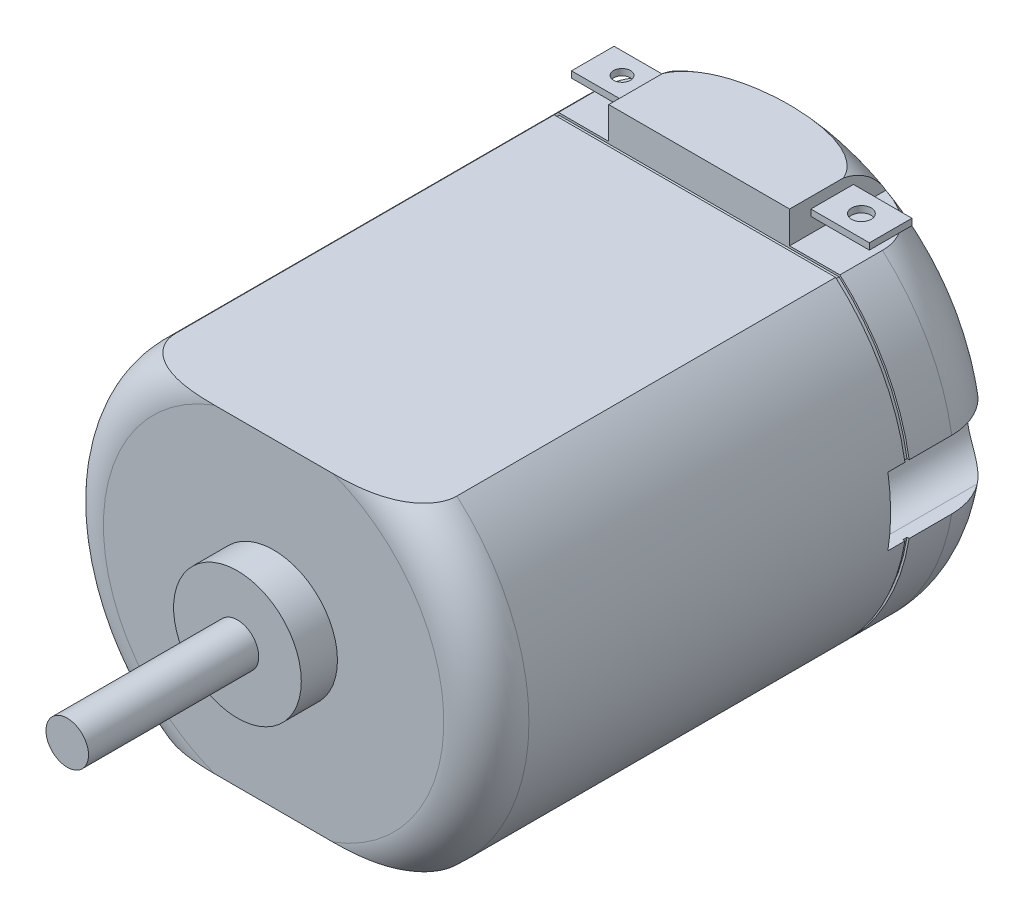
from build123d import *

# Parameters (mm, degrees)
SKETCH_1_R            = 10
EXTRUDE_1_DEPTH       = 25
CUT_EXTRUDE_START     = 5
SKETCH_2_W            = 45.854835026
SKETCH_2_H            = 35
SKETCH_2_W_2          = 25.854835026
SKETCH_2_H_2          = 15
CUT_EXTRUDE_2_DEPTH   = 25
SKETCH_3_R            = 3
EXTRUDE_2_DEPTH       = 1.7
SKETCH_4_R            = 1
EXTRUDE_3_DEPTH       = 8
FILLET_1_R            = 2
FILLET_2_R            = 3
SKETCH_5_W            = 5
SKETCH_5_H            = 0.8
EXTRUDE_4_DEPTH       = 2
EXTRUDE_START         = 1
SKETCH_6_R            = 1
EXTRUDE_5_DEPTH       = 1
CUT_EXTRUDE_1_DEPTH   = 6
CUT_EXTRUDE_3_DEPTH   = 0.2
SKETCH_9_W            = 22.189526506
SKETCH_9_H            = 4.332571278
CUT_EXTRUDE_2_2_DEPTH = 5
EXTRUDE_7_DEPTH       = 7
EXTRUDE_7_DEPTH_BACK  = 7
SKETCH_11_W           = 2
SKETCH_11_H           = 0.3
CUT_EXTRUDE_3_2_REACH = 41.498
SKETCH_12_R           = 0.462491299
SKETCH_12_R_2         = 0.396984266


with BuildPart() as part:
    # Эскиз1 → Бобышка-Вытянуть1 (new body)
    with BuildSketch(Plane.XY):
        Circle(SKETCH_1_R)
    extrude(amount=EXTRUDE_1_DEPTH)

    # Эскиз2 → Cut-Extrude 2 (cut)
    with BuildSketch(Plane.XY.offset(CUT_EXTRUDE_START)):
        Rectangle(SKETCH_2_W, SKETCH_2_H)
        Rectangle(SKETCH_2_W_2, SKETCH_2_H_2, mode=Mode.SUBTRACT)
    extrude(amount=CUT_EXTRUDE_2_DEPTH, mode=Mode.SUBTRACT)

    # Эскиз3 → Бобышка-Вытянуть2 (add)
    with BuildSketch(Plane.XY.offset(25)):
        Circle(SKETCH_3_R)
    extrude(amount=EXTRUDE_2_DEPTH)

    # Эскиз4 → Бобышка-Вытянуть3 (add)
    with BuildSketch(Plane.XY.offset(26.7)):
        Circle(SKETCH_4_R)
    extrude(amount=EXTRUDE_3_DEPTH)

    # Скругление1
    fillet_1_edges = [part.edges().sort_by_distance(p)[0] for p in [
        (-10, 0, 25),
        (9.114378278, 4.114378278, 25),
    ]]
    fillet(fillet_1_edges, radius=FILLET_1_R)

    # Скругление2
    fillet_2_edges = [part.edges().sort_by_distance(p)[0] for p in [
        (-10, 0, 0),
    ]]
    fillet(fillet_2_edges, radius=FILLET_2_R)

    # Эскиз5 → Бобышка-Вытянуть4 (add)
    with BuildSketch(Plane(origin=(0, 0, 0), x_dir=(-1, 0, 0), z_dir=(0, 0, -1))):
        with BuildLine():
            Line((-3.570714214, -3.5), (3.570714214, -3.5))
            ThreePointArc((3.570714214, -3.5), (0, 5), (-3.570714214, -3.5))
        make_face()
        with Locations((0, 2.6)):
            Rectangle(SKETCH_5_W, SKETCH_5_H, mode=Mode.SUBTRACT)
    extrude(amount=EXTRUDE_4_DEPTH)

    # Эскиз6 → Бобышка-Вытянуть5 (add)
    with BuildSketch(Plane(origin=(0, 0, -2), x_dir=(-1, 0, 0), z_dir=(0, 0, -1)).offset(EXTRUDE_START)):
        with Locations(Location((0, 0, 0), (0, 0, 180))):
            Circle(SKETCH_6_R)
    extrude(amount=-EXTRUDE_5_DEPTH)

    # Эскиз7 → Вырез-Вытянуть1 (cut)
    with BuildSketch(Plane.XY):
        with BuildLine():
            Line((9.25, 1.6), (12.510793403, 1.6))
            ThreePointArc((12.510793403, 1.6), (14.110793403, 0), (12.510793403, -1.6))
            Line((12.510793403, -1.6), (9.25, -1.6))
            ThreePointArc((9.25, -1.6), (7.65, 0), (9.25, 1.6))
        make_face()
        with BuildLine():
            Line((-9.25, -1.6), (-13.171375323, -1.6))
            ThreePointArc((-13.171375323, -1.6), (-14.771375323, 0), (-13.171375323, 1.6))
            Line((-13.171375323, 1.6), (-9.25, 1.6))
            ThreePointArc((-9.25, 1.6), (-7.65, 0), (-9.25, -1.6))
        make_face()
    extrude(amount=CUT_EXTRUDE_1_DEPTH, mode=Mode.SUBTRACT)

    # Эскиз8 → Cut-Extrude 3 (cut)
    with BuildSketch(Plane.XY.offset(CUT_EXTRUDE_START)):
        with BuildLine():
            Line((6.652067348, -7.6), (-6.652067348, -7.6))
            ThreePointArc((-6.652067348, -7.6), (-10.1, 0), (-6.652067348, 7.6))
            Line((-6.652067348, 7.6), (6.652067348, 7.6))
            ThreePointArc((6.652067348, 7.6), (10.1, 0), (6.652067348, -7.6))
        make_face()
        with BuildLine():
            Line((6.576473219, -7.4), (-6.576473219, -7.4))
            ThreePointArc((-6.576473219, -7.4), (-9.9, 0), (-6.576473219, 7.4))
            Line((-6.576473219, 7.4), (6.576473219, 7.4))
            ThreePointArc((6.576473219, 7.4), (9.9, 0), (6.576473219, -7.4))
        make_face(mode=Mode.SUBTRACT)
    extrude(amount=CUT_EXTRUDE_3_DEPTH, mode=Mode.SUBTRACT)

    # Эскиз9 → Cut-Extrude 2 2 (cut)
    with BuildSketch(Plane.XY):
        with Locations((0.299905464, -9.666285639)):
            Rectangle(SKETCH_9_W, SKETCH_9_H)
        Polygon((4.25, 9), (-4.25, 9), (-4.25, 7.5), (-7.501825295, 7.5), (-7.501825295, 11.857816674), (7.720330833, 11.857816674), (7.720330833, 7.5), (4.25, 7.5), align=None)
    extrude(amount=CUT_EXTRUDE_2_2_DEPTH, mode=Mode.SUBTRACT)

    # Эскиз11 → Бобышка-Вытянуть7 (add, two sides: drawn at the far end of the back side and taken through both)
    with BuildSketch(Plane(origin=(0, 0, 0), x_dir=(0, 0, -1), z_dir=(1, 0, 0)).offset(-EXTRUDE_7_DEPTH_BACK)):
        with Locations((-3, 8.35)):
            Rectangle(SKETCH_11_W, SKETCH_11_H)
    extrude(amount=EXTRUDE_7_DEPTH + EXTRUDE_7_DEPTH_BACK)

    # Эскиз12 → Cut-Extrude 3 2 (cut, up to next)
    with BuildSketch(Plane(origin=(0, 8.5, 0), x_dir=(1, 0, 0), z_dir=(0, 1, 0)), mode=Mode.PRIVATE) as cut_extrude_3_2_sk1:
        with Locations(Location((5.625, -3, 0), (0, 0, 270))):
            Circle(SKETCH_12_R)
    cut_extrude_3_2_tool1 = extrude(cut_extrude_3_2_sk1.sketch, amount=-CUT_EXTRUDE_3_2_REACH, mode=Mode.PRIVATE) & part.part
    # Эскиз12 → Cut-Extrude 3 2 (cut, up to next)
    with BuildSketch(Plane(origin=(0, 8.5, 0), x_dir=(1, 0, 0), z_dir=(0, 1, 0)), mode=Mode.PRIVATE) as cut_extrude_3_2_sk2:
        with Locations(Location((-5.625, -3, 0), (0, 0, 270))):
            Circle(SKETCH_12_R_2)
    cut_extrude_3_2_tool2 = extrude(cut_extrude_3_2_sk2.sketch, amount=-CUT_EXTRUDE_3_2_REACH, mode=Mode.PRIVATE) & part.part
    add(cut_extrude_3_2_tool1.solids().sort_by_distance((5.625, 8.5, 3))[0], mode=Mode.SUBTRACT)
    add(cut_extrude_3_2_tool2.solids().sort_by_distance((-5.625, 8.5, 3))[0], mode=Mode.SUBTRACT)


solid = part.part
